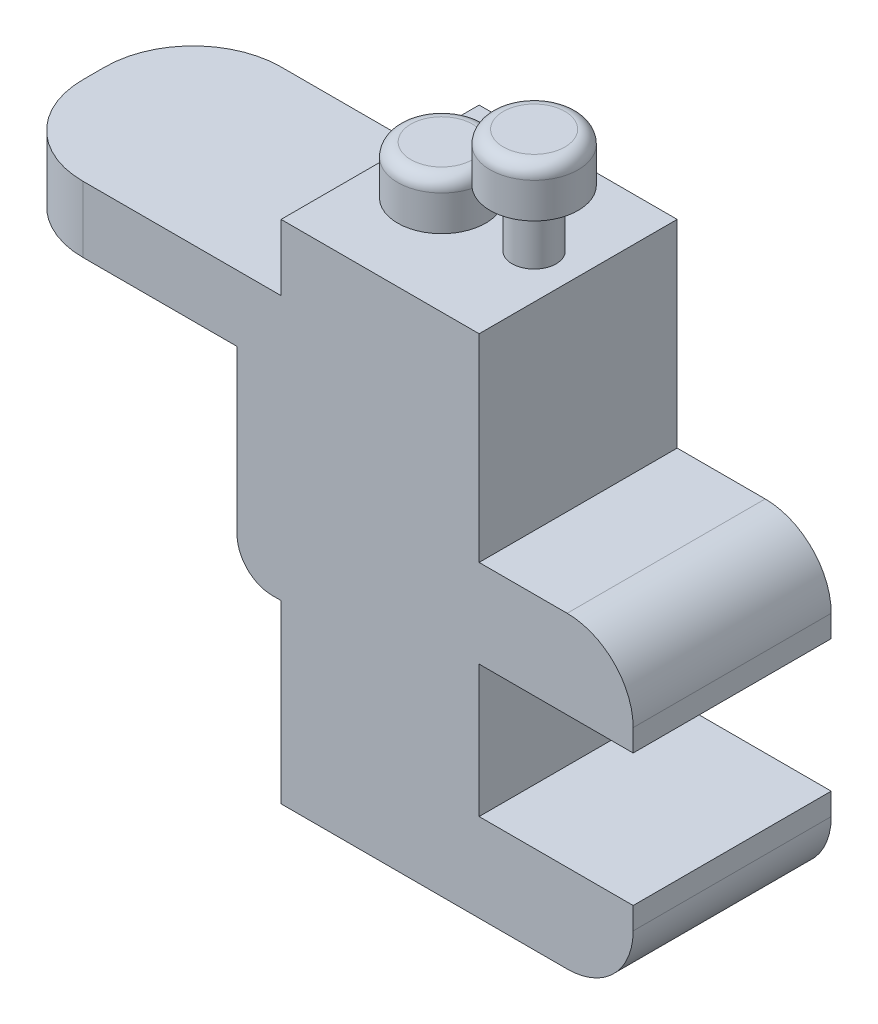
from build123d import *

# Parameters (mm, degrees)
SKETCH1_W           = 45
SKETCH1_H           = 115
BOSS_EXTRUDE1_DEPTH = 45
SKETCH2_W           = 45
SKETCH2_H           = 20
BOSS_EXTRUDE2_DEPTH = 35
BOSS_EXTRUDE3_DEPTH = 45
SKETCH4_R           = 10
BOSS_EXTRUDE4_DEPTH = 11
SKETCH4_3_R         = 5
BOSS_EXTRUDE5_DEPTH = 13
SKETCH6_R           = 10
BOSS_EXTRUDE6_DEPTH = 11
SKETCH7_R           = 10
BOSS_EXTRUDE7_DEPTH = 11
FILLET1_R           = 20
FILLET2_R           = 8
FILLET3_R           = 15
FILLET4_R           = 3


with BuildPart() as part:
    # Sketch1 → Boss-Extrude1 (new body)
    with BuildSketch(Plane.XY):
        Rectangle(SKETCH1_W, SKETCH1_H)
    extrude(amount=-BOSS_EXTRUDE1_DEPTH)

    # Sketch2 → Boss-Extrude2 (add)
    with BuildSketch(Plane(origin=(22.5, 0, 0), x_dir=(0, 0, -1), z_dir=(1, 0, 0))):
        with Locations((22.5, -47.5)):
            Rectangle(SKETCH2_W, SKETCH2_H)
        with Locations((22.5, 2.5)):
            Rectangle(SKETCH2_W, SKETCH2_H)
    extrude(amount=BOSS_EXTRUDE2_DEPTH)

    # Sketch3 → Boss-Extrude3 (add)
    with BuildSketch(Plane.XY):
        Polygon((-22.5, -17.5), (-32.5, -17.5), (-32.5, 27.5), (-87.5, 27.5), (-87.5, 42.5), (-22.5, 42.5), align=None)
    extrude(amount=-BOSS_EXTRUDE3_DEPTH)

    # Sketch4 → Boss-Extrude4 (add)
    with BuildSketch(Plane(origin=(0, 57.5, 0), x_dir=(1, 0, 0), z_dir=(0, 1, 0))):
        with Locations(Location((-8.5, 22.5, 0), (0, 0, 270))):
            Circle(SKETCH4_R)
    extrude(amount=BOSS_EXTRUDE4_DEPTH)

    # Sketch4<3> → Boss-Extrude5 (add)
    with BuildSketch(Plane(origin=(0, 57.5, 0), x_dir=(1, 0, 0), z_dir=(0, 1, 0))):
        with Locations(Location((12.5, 22.5, 0), (0, 0, 90))):
            Circle(SKETCH4_3_R)
    extrude(amount=BOSS_EXTRUDE5_DEPTH)

    # Sketch6 → Boss-Extrude6 (add)
    with BuildSketch(Plane(origin=(0, 70.5, 0), x_dir=(1, 0, 0), z_dir=(0, 1, 0))):
        with Locations(Location((12.5, 22.5, 0), (0, 0, 270))):
            Circle(SKETCH6_R)
    extrude(amount=BOSS_EXTRUDE6_DEPTH)

    # Sketch7 → Boss-Extrude7 (add)
    with BuildSketch(Plane.XZ.offset(-27.5)):
        with Locations((-60, -22.5)):
            Circle(SKETCH7_R)
    extrude(amount=BOSS_EXTRUDE7_DEPTH)

    # Fillet1
    fillet1_edges = [part.edges().sort_by_distance(p)[0] for p in [
        (-87.5, 35, 0),
        (-87.5, 35, -45),
    ]]
    fillet(fillet1_edges, radius=FILLET1_R)

    # Fillet2
    fillet2_edges = [part.edges().sort_by_distance(p)[0] for p in [
        (-32.5, -17.5, -22.5),
    ]]
    fillet(fillet2_edges, radius=FILLET2_R)

    # Fillet3
    fillet3_edges = [part.edges().sort_by_distance(p)[0] for p in [
        (57.5, -57.5, -22.5),
        (57.5, 12.5, -22.5),
    ]]
    fillet(fillet3_edges, radius=FILLET3_R)

    # Fillet4
    fillet4_edges = [part.edges().sort_by_distance(p)[0] for p in [
        (-8.5, 68.5, -32.5),
        (12.5, 81.5, -32.5),
        (-70, 16.5, -22.5),
    ]]
    fillet(fillet4_edges, radius=FILLET4_R)


solid = part.part
